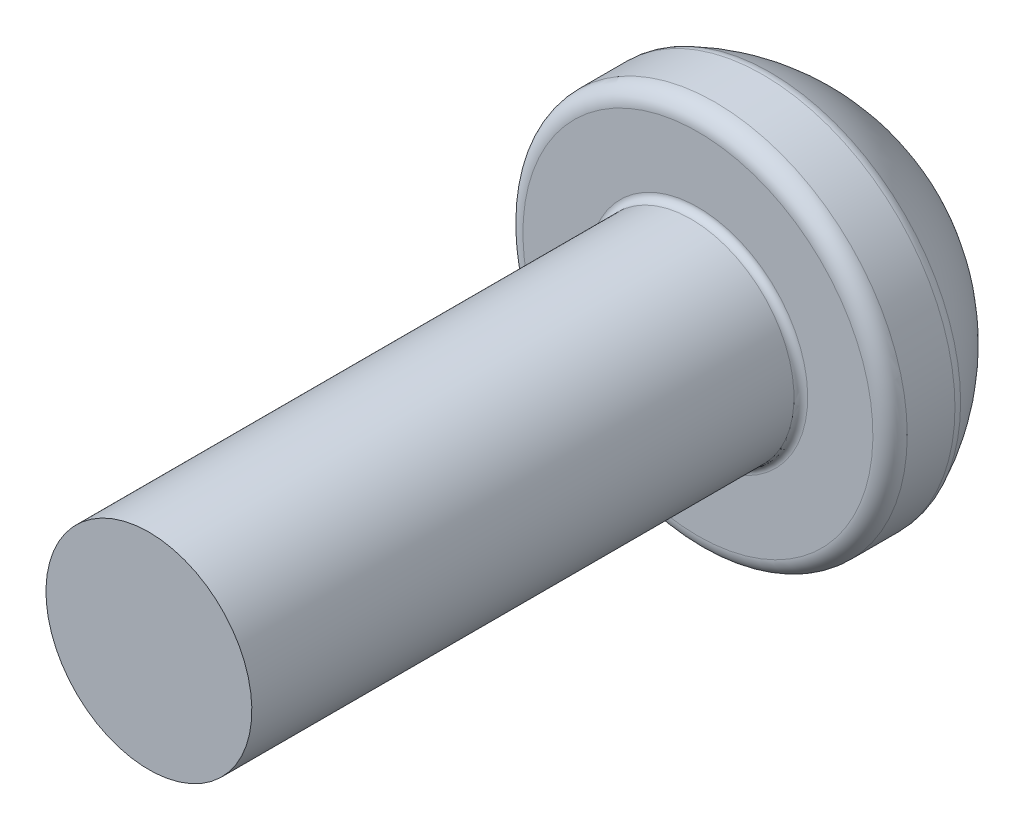
from build123d import *

# Parameters (mm, degrees)
FILLET1_R          = 0.1
FILLET2_R          = 0.25
HOLE1_D            = 2.05
HOLE1_DEPTH        = 1
HOLE1_TIP          = 0.37306949
CUT_EXTRUDE1_DEPTH = 1


with BuildPart() as part:
    # Sketch1 → Base-Revolve (revolve)
    with BuildSketch(Plane(origin=(0, 0, 0), x_dir=(0, 0, -1), z_dir=(1, 0, 0)), mode=Mode.PRIVATE) as base_revolve_sk:
        with BuildLine():
            Line((-8, 0), (-8, 1.5))
            Line((-8, 1.5), (0, 1.5))
            Line((0, 1.5), (0, 2.8))
            Line((0, 2.8), (1, 2.8))
            ThreePointArc((1, 2.8), (1.799098682, 2.280109646), (2.4, 1.54))
            Line((2.4, 1.54), (2.4, 0))
            Line((2.4, 0), (-8, 0))
        make_face()
    revolve(base_revolve_sk.sketch.rotate(Axis((0, 0, -2.4), (0, 0, 1)), 180), axis=Axis((0, 0, -2.4), (0, 0, 1)))

    # Fillet1
    fillet1_edges = [part.edges().sort_by_distance(p)[0] for p in [
        (0, 1.5, 0),
    ]]
    fillet(fillet1_edges, radius=FILLET1_R)

    # Fillet2
    fillet2_edges = [part.edges().sort_by_distance(p)[0] for p in [
        (0, 2.8, 0),
        (0, 2.8, -1),
    ]]
    fillet(fillet2_edges, radius=FILLET2_R)

    # Hole1
    with Locations(Plane(origin=(0, 0, -2.4), x_dir=(-1, 0, 0), z_dir=(0, 0, -1))):
        with Locations((0, 0)):
            Hole(HOLE1_D / 2, depth=HOLE1_DEPTH)
            with Locations((0, 0, -(HOLE1_DEPTH + HOLE1_TIP / 2))):  # 140° drill point
                Cone(0, HOLE1_D / 2, HOLE1_TIP, mode=Mode.SUBTRACT)

    # Sketch4 → Cut-Extrude1 (cut)
    with BuildSketch(Plane(origin=(0, 0, -2.4), x_dir=(-1, 0, 0), z_dir=(0, 0, -1))):
        with BuildLine():
            ThreePointArc((1.088832331, -0.880025088), (1.212435565, -0.7), (1.306540248, -0.502943915))
            ThreePointArc((1.306540248, -0.502943915), (1.025, 0), (1.306540248, 0.502943915))
            ThreePointArc((1.306540248, 0.502943915), (1.212435565, 0.7), (1.088832331, 0.880025088))
            ThreePointArc((1.088832331, 0.880025088), (0.5125, 0.887676039), (0.217707917, 1.382969003))
            ThreePointArc((0.217707917, 1.382969003), (0, 1.4), (-0.217707917, 1.382969003))
            ThreePointArc((-0.217707917, 1.382969003), (-0.5125, 0.887676039), (-1.088832331, 0.880025088))
            ThreePointArc((-1.088832331, 0.880025088), (-1.212435565, 0.7), (-1.306540248, 0.502943915))
            ThreePointArc((-1.306540248, 0.502943915), (-1.025, 0), (-1.306540248, -0.502943915))
            ThreePointArc((-1.306540248, -0.502943915), (-1.212435565, -0.7), (-1.088832331, -0.880025088))
            ThreePointArc((-1.088832331, -0.880025088), (-0.5125, -0.887676039), (-0.217707917, -1.382969003))
            ThreePointArc((-0.217707917, -1.382969003), (0, -1.4), (0.217707917, -1.382969003))
            ThreePointArc((0.217707917, -1.382969003), (0.5125, -0.887676039), (1.088832331, -0.880025088))
        make_face()
    extrude(amount=-CUT_EXTRUDE1_DEPTH, mode=Mode.SUBTRACT)


solid = part.part
